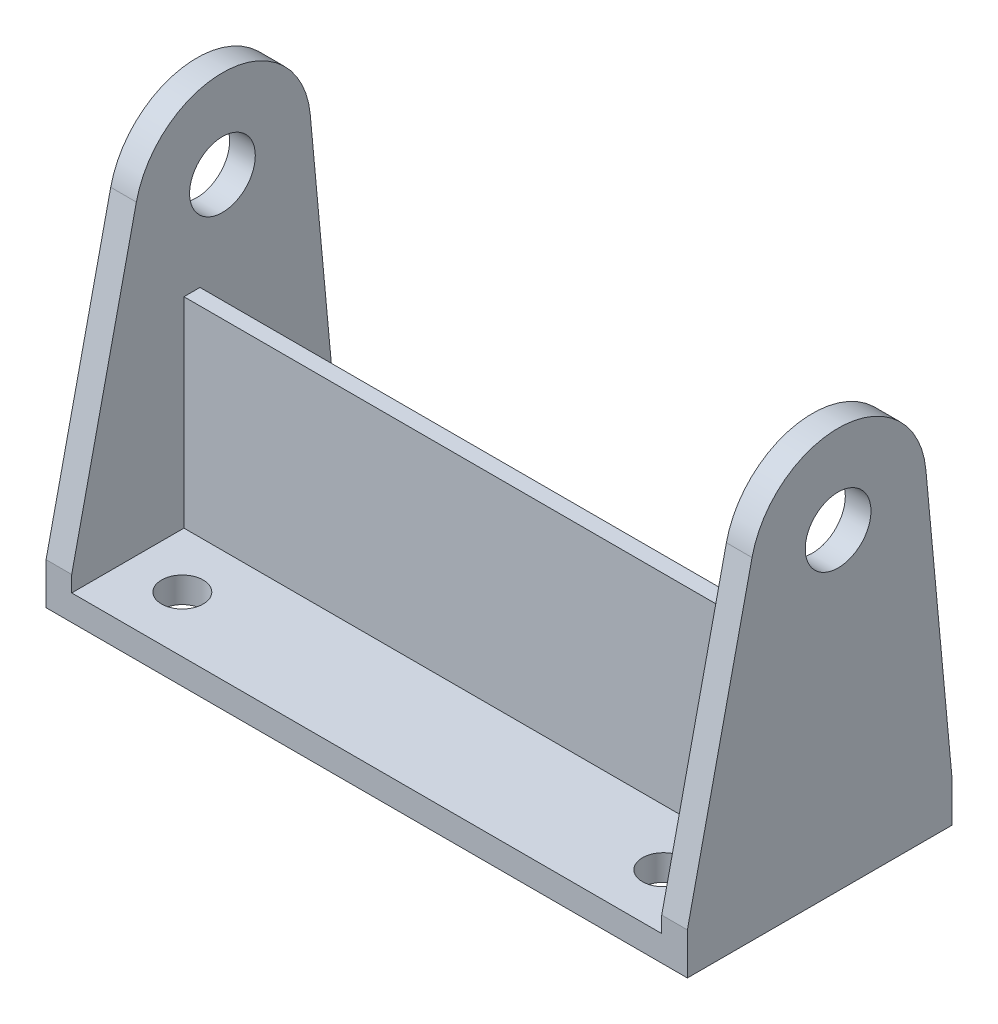
from build123d import *

# Parameters (mm, degrees)
SKETCH_1_W      = 400
SKETCH_1_H      = 165
SKETCH_1_R      = 13
EXTRUDE_1_DEPTH = 16
SKETCH_2_W      = 368
SKETCH_2_H      = 10
EXTRUDE_2_DEPTH = 125
SKETCH_3_R      = 20.5
EXTRUDE_3_DEPTH = 16


with BuildPart() as part:
    # 草图1 → 凸台-拉伸1 (new body)
    with BuildSketch(Plane(origin=(0, 0, 0), x_dir=(1, 0, 0), z_dir=(0, 1, 0))):
        with Locations((200, 82.5)):
            Rectangle(SKETCH_1_W, SKETCH_1_H)
        with Locations(Location((350, 115, 0), (0, 0, 270))):
            Circle(SKETCH_1_R, mode=Mode.SUBTRACT)
        with Locations(Location((50, 115, 0), (0, 0, 270))):
            Circle(SKETCH_1_R, mode=Mode.SUBTRACT)
        with Locations(Location((50, 35, 0), (0, 0, 270))):
            Circle(SKETCH_1_R, mode=Mode.SUBTRACT)
        with Locations(Location((350, 35, 0), (0, 0, 270))):
            Circle(SKETCH_1_R, mode=Mode.SUBTRACT)
    extrude(amount=EXTRUDE_1_DEPTH)

    # 草图2 → 凸台-拉伸2 (add)
    with BuildSketch(Plane(origin=(0, 16, 0), x_dir=(1, 0, 0), z_dir=(0, 1, 0))):
        with Locations((200, 75)):
            Rectangle(SKETCH_2_W, SKETCH_2_H)
    extrude(amount=EXTRUDE_2_DEPTH)

    # 草图3 → 凸台-拉伸3 (add)
    with BuildSketch(Plane(origin=(384, 0, 0), x_dir=(0, 0, -1), z_dir=(1, 0, 0))):
        with BuildLine():
            Line((165, 16), (165, 26))
            Line((165, 26), (148.762358111, 200.107262875))
            ThreePointArc((148.762358111, 200.107262875), (97.468660954, 249.890512761), (40.316177192, 206.960232804))
            Line((40.316177192, 206.960232804), (0, 26))
            Line((0, 26), (0, 16))
            Line((0, 16), (165, 16))
        make_face()
        with Locations((94, 195)):
            Circle(SKETCH_3_R, mode=Mode.SUBTRACT)
    extrude_3 = extrude(amount=EXTRUDE_3_DEPTH)

    # 镜向1: 凸台-拉伸3 across plane
    add(extrude_3.mirror(Plane(origin=(200, 0, 0), x_dir=(0, 0, 1), z_dir=(1, 0, 0))))


solid = part.part
